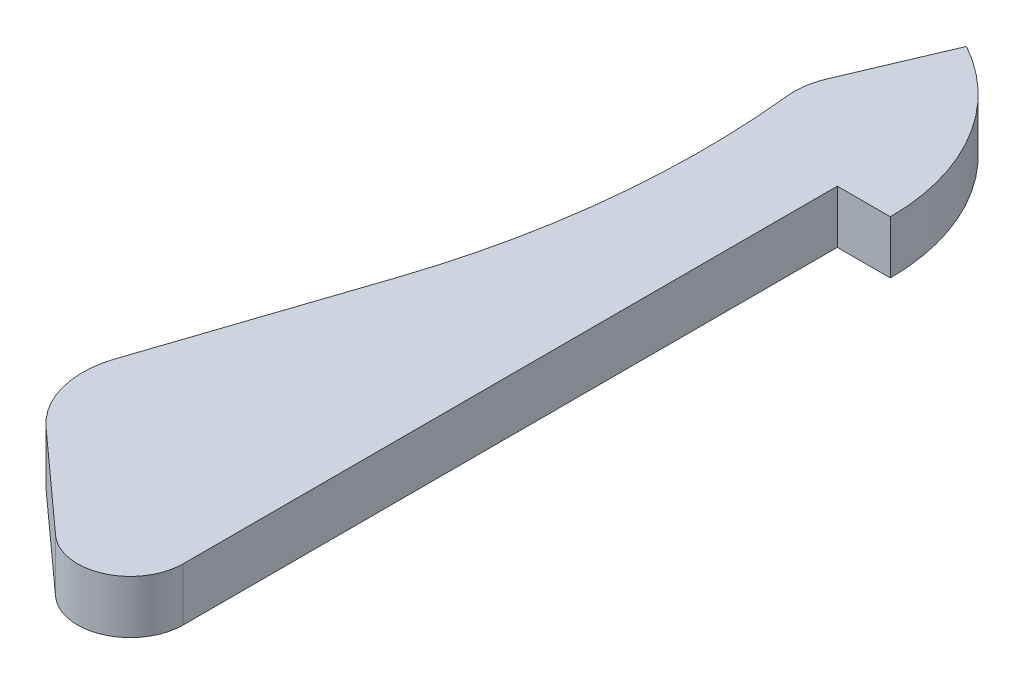
from build123d import *

# Parameters (mm, degrees)
BOSS_EXTRUDE1_DEPTH              = 19.05
F_1_8_0_125_DIAMETER_HOLE1_D     = 3.175
F_1_8_0_125_DIAMETER_HOLE1_DEPTH = 11.1252
F_1_8_0_125_DIAMETER_HOLE1_TIP   = 0.953866233


with BuildPart() as part:
    # Sketch1 → Boss-Extrude1 (new body)
    with BuildSketch(Plane(origin=(0, 0, 0), x_dir=(1, 0, 0), z_dir=(0, 1, 0))):
        with BuildLine():
            Line((0, 0), (0, -234.95))
            ThreePointArc((0, -234.95), (-11.289784316, -252.322290845), (-31.75, -249.061111111))
            Line((-31.75, -249.061111111), (-67.13994853, -217.111852022))
            ThreePointArc((-67.13994853, -217.111852022), (-76.568587152, -201.625781937), (-75.984870047, -183.504610141))
            Line((-75.984870047, -183.504610141), (-50.8, -107.95))
            ThreePointArc((-50.8, -107.95), (-37.112138852, -45.218522559), (-37.04854536, 18.988889479))
            ThreePointArc((-37.04854536, 18.988889479), (-36.913147406, 25.420628086), (-35.166213845, 31.612059039))
            Line((-35.166213845, 31.612059039), (-20.259833627, 66.675))
            ThreePointArc((-20.259833627, 66.675), (8.490957784, 38.700189421), (19.05, 0))
            Line((19.05, 0), (0, 0))
        make_face()
    extrude(amount=BOSS_EXTRUDE1_DEPTH)

    # 1/8 (0.125) Diameter Hole1
    with Locations(Plane(origin=(0, 0, 0), x_dir=(-1, 0, 0), z_dir=(0, -1, 0))):
        with Locations((10.644245878, 21.674472227), (29.633333333, -133.35), (22.234526543, -227.696620833)):
            Hole(F_1_8_0_125_DIAMETER_HOLE1_D / 2, depth=F_1_8_0_125_DIAMETER_HOLE1_DEPTH)
            with Locations((0, 0, -(F_1_8_0_125_DIAMETER_HOLE1_DEPTH + F_1_8_0_125_DIAMETER_HOLE1_TIP / 2))):  # 118° drill point
                Cone(0, F_1_8_0_125_DIAMETER_HOLE1_D / 2, F_1_8_0_125_DIAMETER_HOLE1_TIP, mode=Mode.SUBTRACT)


solid = part.part
